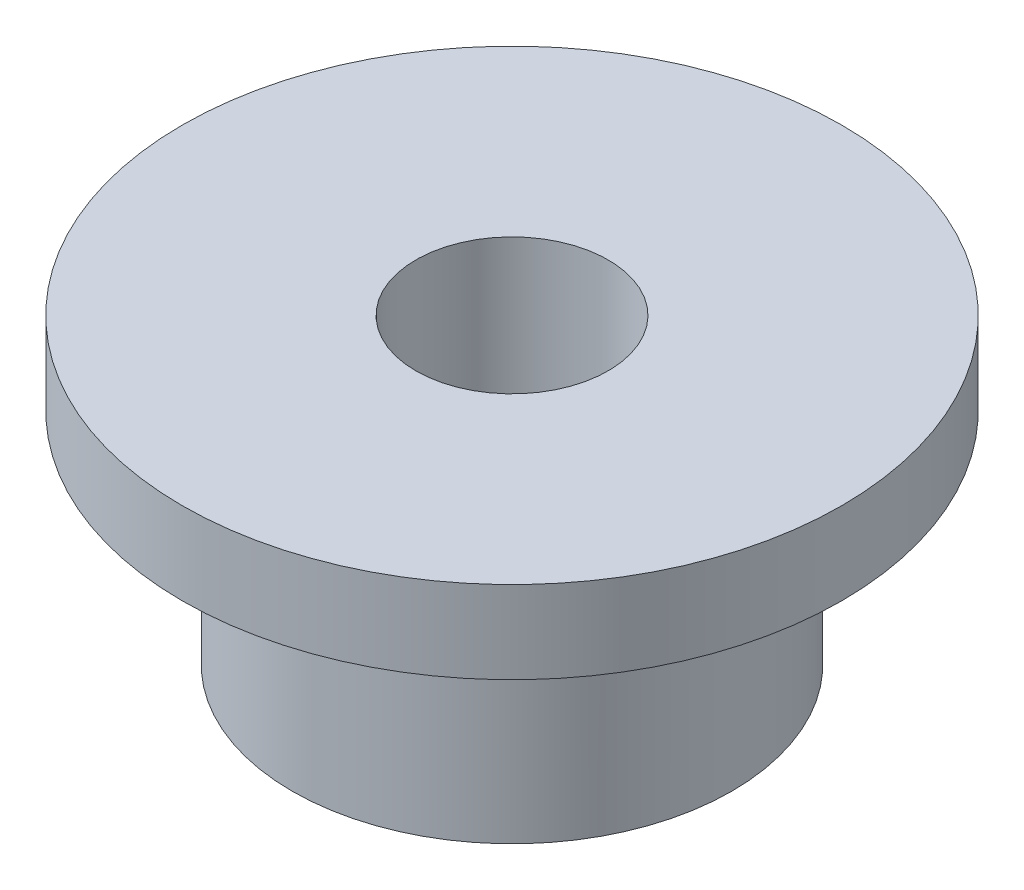
from build123d import *

# Parameters (mm, degrees)
SKETCH_1_R          = 12
EXTRUDE_1_DEPTH     = 3
SKETCH_2_R          = 8
EXTRUDE_2_DEPTH     = 8
SKETCH_3_R          = 3.5
CUT_EXTRUDE_1_DEPTH = 8


with BuildPart() as part:
    # Эскиз1 → Вытянуть1 (new body)
    with BuildSketch(Plane(origin=(0, 0, 0), x_dir=(1, 0, 0), z_dir=(0, 1, 0))):
        with Locations(Location((0, 0, 0), (0, 0, 270))):
            Circle(SKETCH_1_R)
    extrude(amount=EXTRUDE_1_DEPTH)

    # Эскиз2 → Вытянуть2 (add)
    with BuildSketch(Plane.XZ):
        with Locations(Location((0, 0, 0), (0, 0, 90))):
            Circle(SKETCH_2_R)
    extrude(amount=EXTRUDE_2_DEPTH)

    # Эскиз3 → Вырез-Вытянуть1 (cut)
    with BuildSketch(Plane(origin=(0, 3, 0), x_dir=(1, 0, 0), z_dir=(0, 1, 0))):
        with Locations(Location((0, 0, 0), (0, 0, 270))):
            Circle(SKETCH_3_R)
    extrude(amount=-CUT_EXTRUDE_1_DEPTH, mode=Mode.SUBTRACT)


solid = part.part
